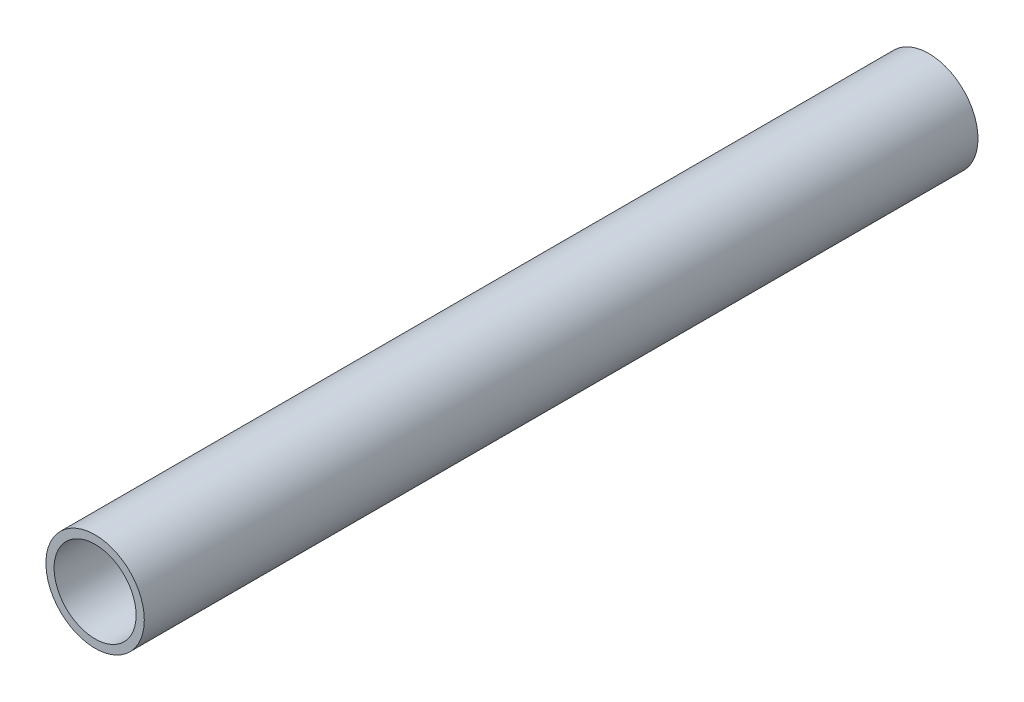
from build123d import *

# Parameters (mm, degrees)
ESQUISSE1_R        = 18
ESQUISSE1_R_2      = 15
EXTRU_MINCE1_DEPTH = 305


with BuildPart() as part:
    # Esquisse1 → Extru.-Mince1 (new body)
    with BuildSketch(Plane.XY):
        Circle(ESQUISSE1_R)
        Circle(ESQUISSE1_R_2, mode=Mode.SUBTRACT)
    extrude(amount=EXTRU_MINCE1_DEPTH)


solid = part.part
